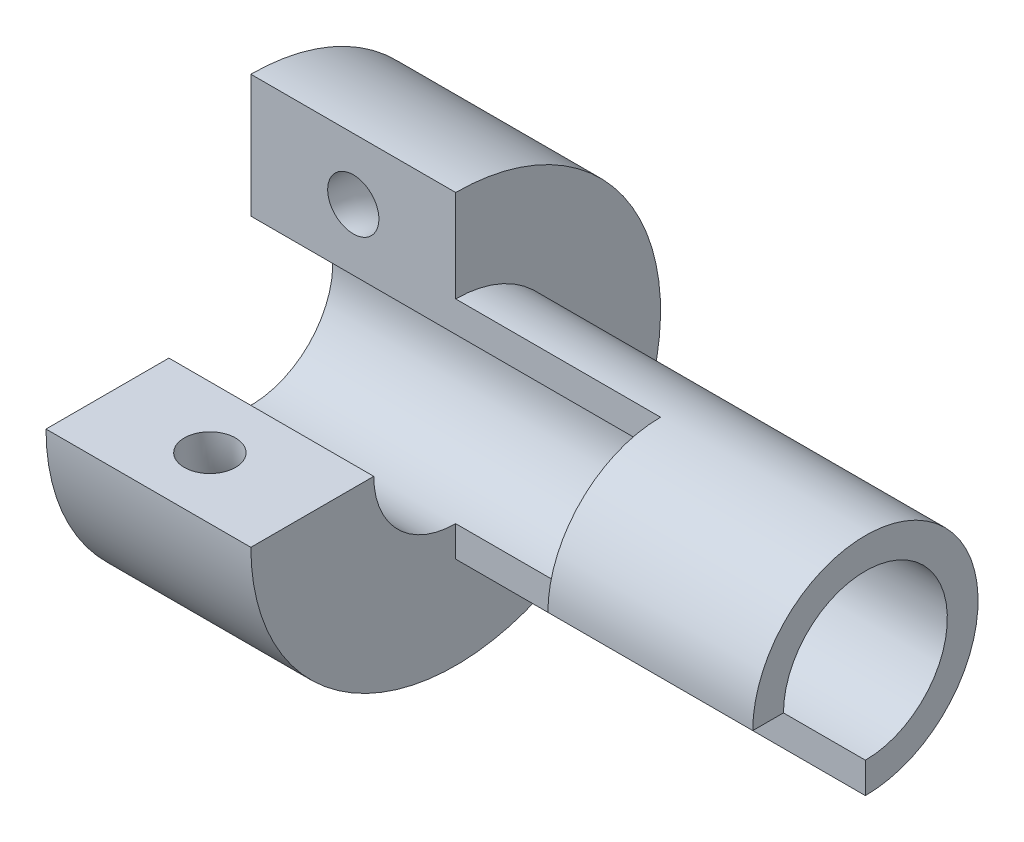
from build123d import *
from build123d.topology import SkipClean

# Parameters (mm, degrees)
SKETCH1_R               = 20
SKETCH1_R_2             = 11
BOSS_EXTRUDE1_DEPTH     = 20
SKETCH1_4_R             = 11
SKETCH1_4_R_2           = 8
BOSS_EXTRUDE2_DEPTH     = 40
CUT_EXTRUDE5_START      = 40
CUT_EXTRUDE5_DEPTH      = 40
SKETCH1_5_R             = 11
SKETCH1_5_R_2           = 8
BOSS_EXTRUDE3_DEPTH     = 20
CUT_EXTRUDE7_DEPTH      = 20
CUT_EXTRUDE8_DEPTH      = 20
CUT_EXTRUDE8_DEPTH_BACK = 20
SKETCH8_R               = 2.5


with BuildPart() as part:
    # Sketch1 → Boss-Extrude1 (new body)
    with BuildSketch(Plane(origin=(0, 0, 0), x_dir=(0, 0, -1), z_dir=(1, 0, 0))):
        Circle(SKETCH1_R)
        Circle(SKETCH1_R_2, mode=Mode.SUBTRACT)
    extrude(amount=-BOSS_EXTRUDE1_DEPTH)



with BuildPart() as body_2:
    # Sketch1<4> → Boss-Extrude2 (new body)
    with BuildSketch(Plane(origin=(0, 0, 0), x_dir=(0, 0, -1), z_dir=(1, 0, 0))):
        Circle(SKETCH1_4_R)
        Circle(SKETCH1_4_R_2, mode=Mode.SUBTRACT)
    extrude(amount=BOSS_EXTRUDE2_DEPTH)

    # Sketch4 → Cut-Extrude5 (cut)
    with BuildSketch(Plane(origin=(0, 0, 0), x_dir=(0, 0, -1), z_dir=(1, 0, 0)).offset(CUT_EXTRUDE5_START)):
        with BuildLine():
            Line((-11, 0), (-8, 0))
            ThreePointArc((-8, 0), (-5.656854249, -5.656854249), (0, -8))
            Line((0, -8), (0, -11))
            ThreePointArc((0, -11), (-7.778174593, -7.778174593), (-11, 0))
        make_face()
    extrude(amount=-CUT_EXTRUDE5_DEPTH, mode=Mode.SUBTRACT)


with BuildPart() as part_1:
    with SkipClean():  # the faces are left unmerged after this step: merging them gives an invalid solid
        add(part.part)

        add(body_2.part)  # Boss-Extrude3 merges body 2
        # Sketch1<5> → Boss-Extrude3 (add)
        with BuildSketch(Plane(origin=(0, 0, 0), x_dir=(0, 0, -1), z_dir=(1, 0, 0))):
            Circle(SKETCH1_5_R)
            Circle(SKETCH1_5_R_2, mode=Mode.SUBTRACT)
        extrude(amount=-BOSS_EXTRUDE3_DEPTH)

    # Sketch6 → Cut-Extrude7 (cut)
    with SkipClean():  # the faces are left unmerged after this step: merging them gives an invalid solid
        with BuildSketch(Plane(origin=(0, 0, 0), x_dir=(0, 0, -1), z_dir=(1, 0, 0))):
            with BuildLine():
                Line((0, 11), (0, 20))
                ThreePointArc((0, 20), (-14.142135624, 14.142135624), (-20, 0))
                Line((-20, 0), (-11, 0))
                ThreePointArc((-11, 0), (-7.778174593, 7.778174593), (0, 11))
            make_face()
        extrude(amount=-CUT_EXTRUDE7_DEPTH, mode=Mode.SUBTRACT)

    # Sketch7 → Cut-Extrude8 (cut, two sides: drawn at the far end of the back side and taken through both)
    with BuildSketch(Plane(origin=(0, 0, 0), x_dir=(0, 0, -1), z_dir=(1, 0, 0)).offset(-CUT_EXTRUDE8_DEPTH_BACK)):
        with BuildLine():
            Line((-11, 0), (-8, 0))
            ThreePointArc((-8, 0), (-5.656854249, 5.656854249), (0, 8))
            Line((0, 8), (0, 11))
            ThreePointArc((0, 11), (-7.778174593, 7.778174593), (-11, 0))
        make_face()
    extrude(amount=CUT_EXTRUDE8_DEPTH + CUT_EXTRUDE8_DEPTH_BACK, mode=Mode.SUBTRACT)

    # Cut-Sweep1: sweep along a path in Sketch10
    with BuildLine(Plane.ZY.offset(10)) as cut_sweep1_path:
        CenterArc((0, 0), 14, 0, 360)
    # Sketch8 → Cut-Sweep1 (sweep, cut)
    with BuildSketch(Plane.XY):
        with Locations((-10, 14)):
            Circle(SKETCH8_R)
    sweep(path=cut_sweep1_path.line, mode=Mode.SUBTRACT)


solid = part_1.part
